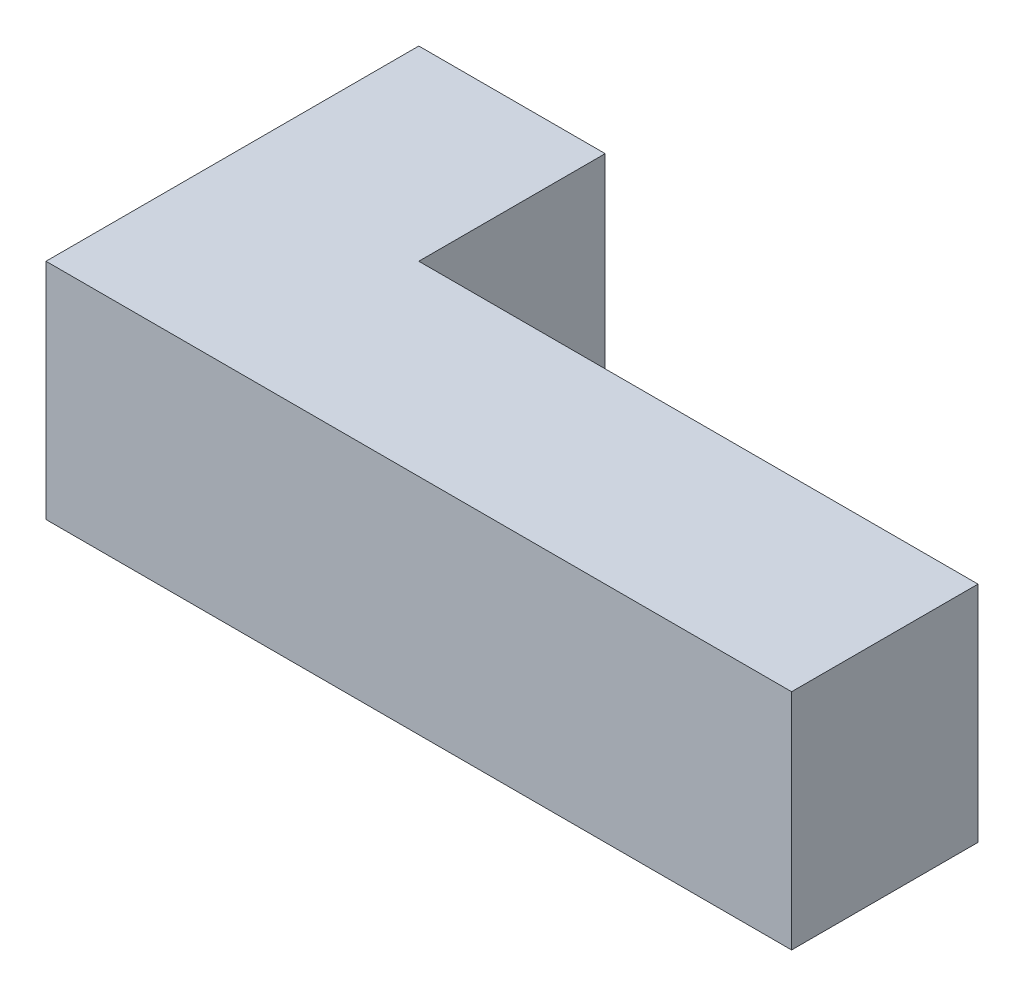
from build123d import *

# Parameters (mm, degrees)
P_IDAT_VYSUNUT_M1_DEPTH = 30


with BuildPart() as part:
    # Skica1 → Přidat vysunutím1 (new body)
    with BuildSketch(Plane(origin=(0, 0, 0), x_dir=(1, 0, 0), z_dir=(0, 1, 0))):
        Polygon((100, 25), (100, 0), (0, 0), (0, 50), (25, 50), (25, 25), align=None)
    extrude(amount=P_IDAT_VYSUNUT_M1_DEPTH)


solid = part.part
